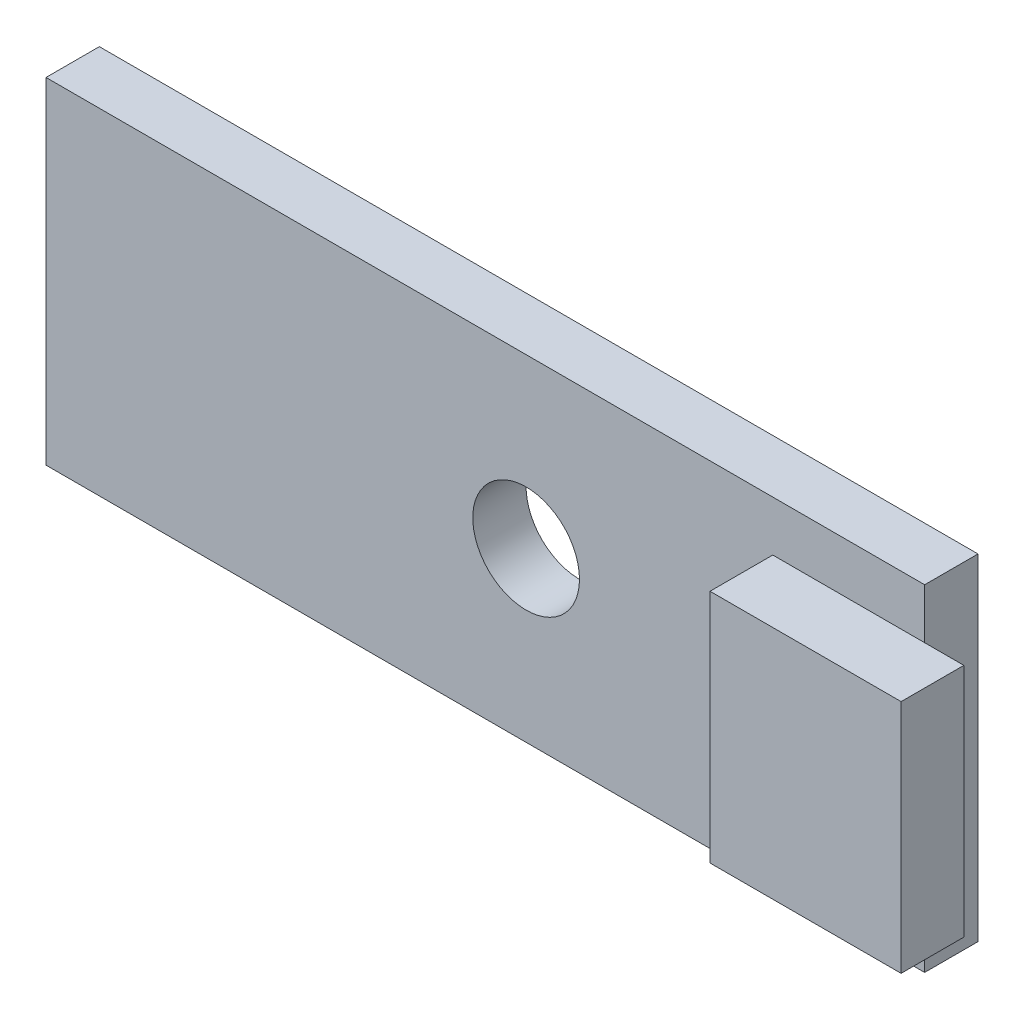
from build123d import *

# Parameters (mm, degrees)
SKETCH1_W           = 28
SKETCH1_H           = 10.7
BOSS_EXTRUDE1_DEPTH = 1.7
SKETCH2_R           = 1.7
CUT_EXTRUDE1_DEPTH  = 16.083517494
SKETCH3_W           = 6.09
SKETCH3_H           = 7.5
BOSS_EXTRUDE2_DEPTH = 2


with BuildPart() as part:
    # Sketch1 → Boss-Extrude1 (new body)
    with BuildSketch(Plane.XY):
        Rectangle(SKETCH1_W, SKETCH1_H)
    extrude(amount=BOSS_EXTRUDE1_DEPTH)

    # Sketch2 → Cut-Extrude1 (cut, through all)
    with BuildSketch(Plane.XY.offset(1.7)):
        with Locations((1.3, 0)):
            Circle(SKETCH2_R)
    extrude(amount=-CUT_EXTRUDE1_DEPTH, mode=Mode.SUBTRACT)

    # Sketch3 → Boss-Extrude2 (add)
    with BuildSketch(Plane.XY.offset(1.7)):
        with Locations((12.205, 0)):
            Rectangle(SKETCH3_W, SKETCH3_H)
    extrude(amount=BOSS_EXTRUDE2_DEPTH)


solid = part.part
